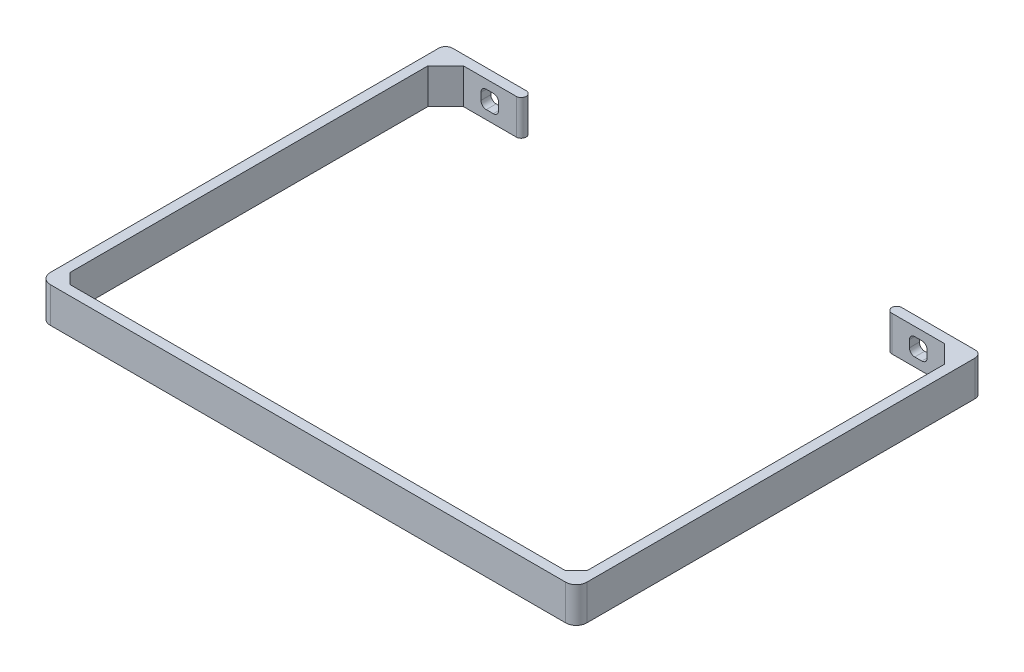
from build123d import *

# Parameters (mm, degrees)
ESBO_O1_W      = 152
ESBO_O1_H      = 115
ESBO_O1_W_2    = 146.4
ESBO_O1_H_2    = 109.4
PAREDES_DEPTH  = 10
FILETE1_R      = 3
FILETE2_R      = 3
FILETE3_R      = 2
FILETE4_R      = 2
CHANFRO1_SIZE  = 3
CHANFRO2_SIZE  = 3
CHANFRO3_SIZE  = 5
CHANFRO4_SIZE  = 5
ESBO_O3_W      = 103.6
ESBO_O3_H      = 10
CORTES_DEPTH   = 10
FILETE7_RADIUS = 1.4
FILETE7_LENGTH = 10
FILETE8_RADIUS = 1.4
FILETE8_LENGTH = 10


with BuildPart() as part:
    # Esboço1 → Paredes (new body)
    with BuildSketch(Plane(origin=(0, 0, 0), x_dir=(1, 0, 0), z_dir=(0, 1, 0))):
        Rectangle(ESBO_O1_W, ESBO_O1_H)
        Rectangle(ESBO_O1_W_2, ESBO_O1_H_2, mode=Mode.SUBTRACT)
    extrude(amount=PAREDES_DEPTH)

    # Filete1
    filete1_edges = [part.edges().sort_by_distance(p)[0] for p in [
        (76, 5, 57.5),
    ]]
    fillet(filete1_edges, radius=FILETE1_R)

    # Filete2
    filete2_edges = [part.edges().sort_by_distance(p)[0] for p in [
        (-76, 5, 57.5),
    ]]
    fillet(filete2_edges, radius=FILETE2_R)

    # Filete3
    filete3_edges = [part.edges().sort_by_distance(p)[0] for p in [
        (76, 5, -57.5),
    ]]
    fillet(filete3_edges, radius=FILETE3_R)

    # Filete4
    filete4_edges = [part.edges().sort_by_distance(p)[0] for p in [
        (-76, 5, -57.5),
    ]]
    fillet(filete4_edges, radius=FILETE4_R)

    # Chanfro1
    chanfro1_edges = [part.edges().sort_by_distance(p)[0] for p in [
        (73.2, 5, 54.7),
    ]]
    chamfer(chanfro1_edges, length=CHANFRO1_SIZE)

    # Chanfro2
    chanfro2_edges = [part.edges().sort_by_distance(p)[0] for p in [
        (-73.2, 5, 54.7),
    ]]
    chamfer(chanfro2_edges, length=CHANFRO2_SIZE)

    # Chanfro3
    chanfro3_edges = [part.edges().sort_by_distance(p)[0] for p in [
        (-73.2, 5, -54.7),
    ]]
    chamfer(chanfro3_edges, length=CHANFRO3_SIZE)

    # Chanfro4
    chanfro4_edges = [part.edges().sort_by_distance(p)[0] for p in [
        (73.2, 5, -54.7),
    ]]
    chamfer(chanfro4_edges, length=CHANFRO4_SIZE)

    # Esboço3 → Cortes (cut)
    with BuildSketch(Plane(origin=(0, 0, -57.5), x_dir=(-1, 0, 0), z_dir=(0, 0, -1))):
        with BuildLine():
            Line((63.2, 6), (63.2, 4))
            ThreePointArc((63.2, 4), (62.760660172, 2.939339828), (61.7, 2.5))
            Line((61.7, 2.5), (59.7, 2.5))
            ThreePointArc((59.7, 2.5), (58.639339828, 2.939339828), (58.2, 4))
            Line((58.2, 4), (58.2, 6))
            ThreePointArc((58.2, 6), (58.639339828, 7.060660172), (59.7, 7.5))
            Line((59.7, 7.5), (61.7, 7.5))
            ThreePointArc((61.7, 7.5), (62.760660172, 7.060660172), (63.2, 6))
        make_face()
        with BuildLine():
            Line((-61.7, 7.5), (-59.7, 7.5))
            ThreePointArc((-59.7, 7.5), (-58.639339828, 7.060660172), (-58.2, 6))
            Line((-58.2, 6), (-58.2, 4))
            ThreePointArc((-58.2, 4), (-58.639339828, 2.939339828), (-59.7, 2.5))
            Line((-59.7, 2.5), (-61.7, 2.5))
            ThreePointArc((-61.7, 2.5), (-62.760660172, 2.939339828), (-63.2, 4))
            Line((-63.2, 4), (-63.2, 6))
            ThreePointArc((-63.2, 6), (-62.760660172, 7.060660172), (-61.7, 7.5))
        make_face()
        with Locations((0, 5)):
            Rectangle(ESBO_O3_W, ESBO_O3_H)
    extrude(amount=-CORTES_DEPTH, mode=Mode.SUBTRACT)

    # Filete7: full round fillet: the end face becomes a half cylinder, R = half its width
    filete7_face = Plane((51.8, 5, -56.1), x_dir=(0, 1, 0), z_dir=(-1, 0, 0))  # on the end face: x along it, z out of the body
    filete7_slab = filete7_face.offset(-FILETE7_RADIUS / 2) * Box(FILETE7_LENGTH, 2 * FILETE7_RADIUS, FILETE7_RADIUS, mode=Mode.PRIVATE)  # the body's end, R deep
    filete7_round = Plane((53.2, 5, -56.1), x_dir=(-1, 0, 0), z_dir=(0, 1, 0)) * Cylinder(FILETE7_RADIUS, FILETE7_LENGTH, mode=Mode.PRIVATE)  # its axis R under the face
    add(filete7_slab - filete7_round, mode=Mode.SUBTRACT)

    # Filete8: full round fillet: the end face becomes a half cylinder, R = half its width
    filete8_face = Plane((-51.8, 5, -56.1), x_dir=(0, -1, 0), z_dir=(1, 0, 0))  # on the end face: x along it, z out of the body
    filete8_slab = filete8_face.offset(-FILETE8_RADIUS / 2) * Box(FILETE8_LENGTH, 2 * FILETE8_RADIUS, FILETE8_RADIUS, mode=Mode.PRIVATE)  # the body's end, R deep
    filete8_round = Plane((-53.2, 5, -56.1), x_dir=(1, 0, 0), z_dir=(0, -1, 0)) * Cylinder(FILETE8_RADIUS, FILETE8_LENGTH, mode=Mode.PRIVATE)  # its axis R under the face
    add(filete8_slab - filete8_round, mode=Mode.SUBTRACT)


solid = part.part
